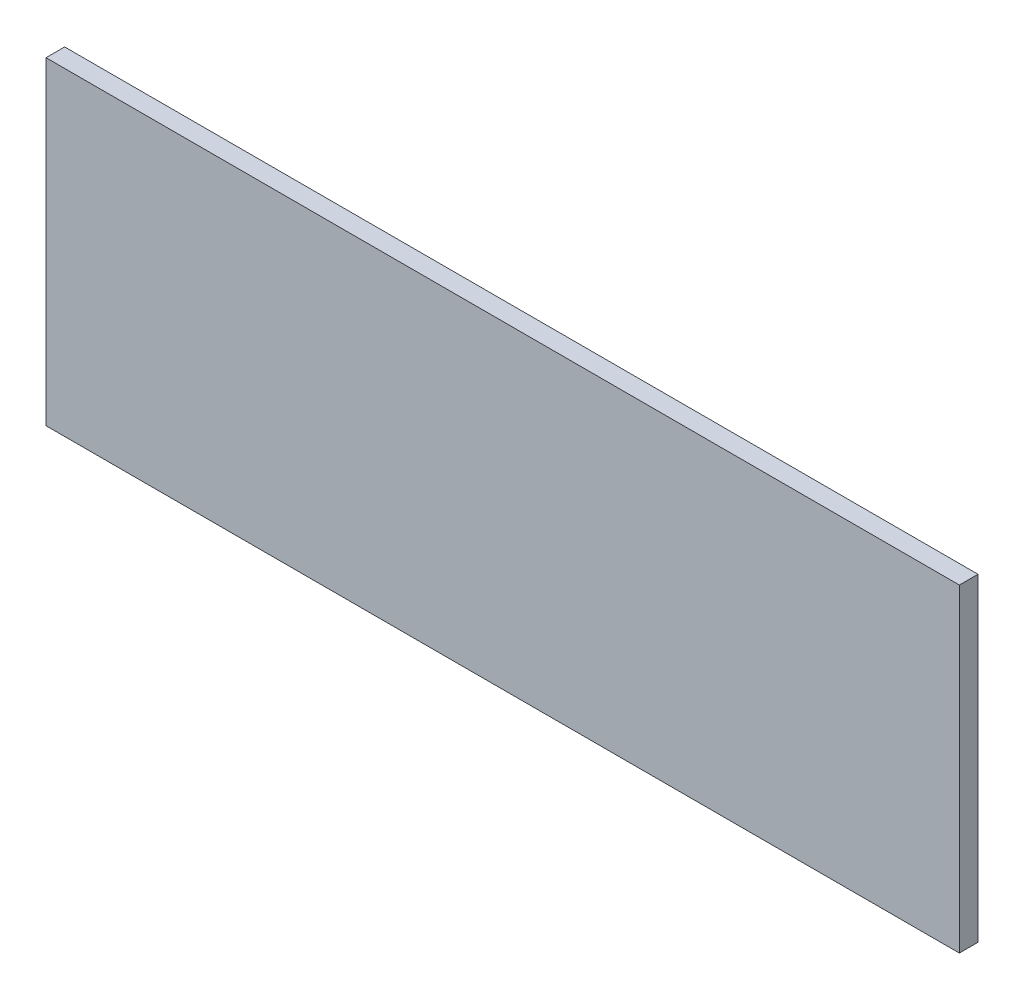
from build123d import *

# Parameters (mm, degrees)
CROQUIS1_W              = 98
CROQUIS1_H              = 34.2
SALIENTE_EXTRUIR1_DEPTH = 2


with BuildPart() as part:
    # Croquis1 → Saliente-Extruir1 (new body)
    with BuildSketch(Plane.XY):
        Rectangle(CROQUIS1_W, CROQUIS1_H)
    extrude(amount=SALIENTE_EXTRUIR1_DEPTH)


solid = part.part
